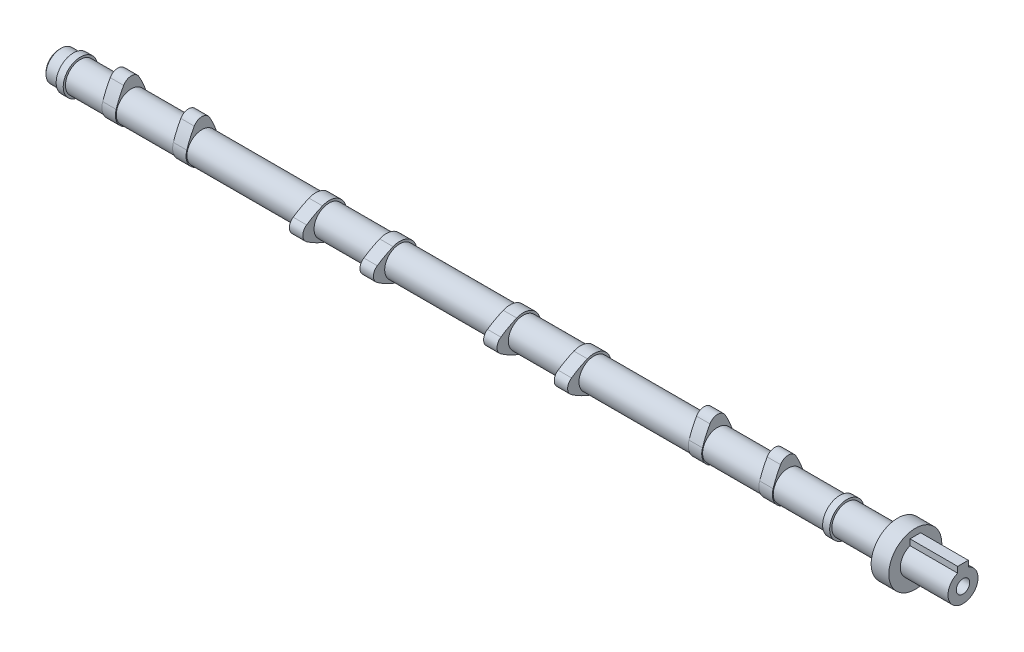
from build123d import *

# Parameters (mm, degrees)
CROQUIS1_W                       = 580
CROQUIS1_H                       = 8.5
CROQUIS4_R                       = 9.75
SALIENTE_EXTRUIR1_DEPTH          = 4
MATRIZL1_COUNT                   = 2
MATRIZL1_PITCH                   = 442
SALIENTE_EXTRUIR3_DEPTH          = 3.8
MATRIZL2_COUNT                   = 2
MATRIZL2_PITCH                   = 40
MATRIZL3_COUNT                   = 2
MATRIZL3_PITCH                   = 332
MATRIZL3_COPY_1_DEPTH            = 3.8
CROQUIS6_R                       = 8.5
SALIENTE_EXTRUIR4_DEPTH          = 3.8
MATRIZL4_COUNT                   = 2
MATRIZL4_PITCH                   = 40
MATRIZL5_COUNT                   = 2
MATRIZL5_PITCH                   = 110
MATRIZL5_COPY_1_SKETCH_R         = 8.5
MATRIZL5_COPY_1_DEPTH            = 3.8
CROQUIS7_R                       = 9.75
CORTAR_EXTRUIR1_DEPTH            = 12
CROQUIS8_R                       = 9.75
SALIENTE_EXTRUIR5_DEPTH          = 4
CROQUIS9_R                       = 8.5
SALIENTE_EXTRUIR6_DEPTH          = 8
CHAFL_N1_SIZE                    = 1
SALIENTE_EXTRUIR7_DEPTH          = 5
SALIENTE_EXTRUIR7_DEPTH_BACK     = 5
CROQUIS10_R                      = 15
CROQUIS11_W                      = 6
CROQUIS11_H                      = 3.35
SALIENTE_EXTRUIR8_DEPTH          = 40
CORTAR_EXTRUIR2_START            = -68.25
CROQUIS12_R                      = 42.065931182
CORTAR_EXTRUIR2_DEPTH            = 68.25
TALADRO_DE_MARGEN_PARA_M71_D     = 7.6
TALADRO_DE_MARGEN_PARA_M71_DEPTH = 30
TALADRO_DE_MARGEN_PARA_M71_TIP   = 2.283270352


with BuildPart() as part:
    # Croquis1 → Revolución1 (revolve)
    with BuildSketch(Plane.XY, mode=Mode.PRIVATE) as revoluci_n1_sk:
        with Locations((290, 4.25)):
            Rectangle(CROQUIS1_W, CROQUIS1_H)
    revolve(revoluci_n1_sk.sketch.rotate(Axis((0, 8.5, 0), (1, 0, 0)), 270), axis=Axis((0, 8.5, 0), (1, 0, 0)))

    # Croquis4 → Saliente-Extruir1 (add)
    with BuildSketch(Plane(origin=(580, 0, 0), x_dir=(0, 0, -1), z_dir=(1, 0, 0))):
        with Locations((0, 8.5)):
            Circle(CROQUIS4_R)
    saliente_extruir1 = extrude(amount=-SALIENTE_EXTRUIR1_DEPTH)

    # MatrizL1: Saliente-Extruir1 ×2
    with Locations(*[(-i * MATRIZL1_PITCH, 0, 0) for i in range(1, MATRIZL1_COUNT)]):
        add(saliente_extruir1)

    # Croquis5 → Saliente-Extruir3 (add, symmetric)
    with BuildSketch(Plane(origin=(171, 0, 0), x_dir=(0, 0, -1), z_dir=(1, 0, 0))):
        with BuildLine():
            ThreePointArc((-8.57686354, 11.227161863), (0, -0.5), (8.57686354, 11.227161863))
            ThreePointArc((8.57686354, 11.227161863), (6.71423124, 16.165722115), (4.341375372, 20.880415264))
            ThreePointArc((4.341375372, 20.880415264), (0, 23.4), (-4.341375372, 20.880415264))
            ThreePointArc((-4.341375372, 20.880415264), (-6.71423124, 16.165722115), (-8.57686354, 11.227161863))
        make_face()
    saliente_extruir3 = extrude(amount=SALIENTE_EXTRUIR3_DEPTH, both=True)

    # MatrizL2: Saliente-Extruir3 ×2
    with Locations(*[(i * MATRIZL2_PITCH, 0, 0) for i in range(1, MATRIZL2_COUNT)]):
        add(saliente_extruir3)

    # MatrizL3: Saliente-Extruir3 ×2
    with Locations(*[(i * MATRIZL3_PITCH, 0, 0) for i in range(1, MATRIZL3_COUNT)]):
        add(saliente_extruir3)

    # MatrizL3 copy 1 sketch → MatrizL3 copy 1 (add, symmetric)
    with BuildSketch(Plane(origin=(543, 0, 0), x_dir=(0, 0, -1), z_dir=(1, 0, 0))):
        with BuildLine():
            ThreePointArc((-8.57686354, 11.227161863), (0, -0.5), (8.57686354, 11.227161863))
            ThreePointArc((8.57686354, 11.227161863), (6.71423124, 16.165722115), (4.341375372, 20.880415264))
            ThreePointArc((4.341375372, 20.880415264), (0, 23.4), (-4.341375372, 20.880415264))
            ThreePointArc((-4.341375372, 20.880415264), (-6.71423124, 16.165722115), (-8.57686354, 11.227161863))
        make_face()
    extrude(amount=MATRIZL3_COPY_1_DEPTH, both=True)

    # Croquis6 → Saliente-Extruir4 (add, symmetric)
    with BuildSketch(Plane(origin=(281, 0, 0), x_dir=(0, 0, -1), z_dir=(1, 0, 0))):
        with BuildLine():
            ThreePointArc((-12.722376543, 12.627249768), (-14.9, 8.5), (-12.722376543, 4.372750232))
            ThreePointArc((-12.722376543, 4.372750232), (-8.363270987, 1.70804262), (-3.754994824, -0.497917196))
            ThreePointArc((-3.754994824, -0.497917196), (9.75, 8.5), (-3.754994824, 17.497917196))
            ThreePointArc((-3.754994824, 17.497917196), (-8.363270987, 15.29195738), (-12.722376543, 12.627249768))
        make_face()
        with Locations(Location((0, 8.5, 0), (0, 0, 180))):
            Circle(CROQUIS6_R, mode=Mode.SUBTRACT)
    saliente_extruir4 = extrude(amount=SALIENTE_EXTRUIR4_DEPTH, both=True)

    # MatrizL4: Saliente-Extruir4 ×2
    with Locations(*[(i * MATRIZL4_PITCH, 0, 0) for i in range(1, MATRIZL4_COUNT)]):
        add(saliente_extruir4)

    # MatrizL5: Saliente-Extruir4 ×2
    with Locations(*[(i * MATRIZL5_PITCH, 0, 0) for i in range(1, MATRIZL5_COUNT)]):
        add(saliente_extruir4)

    # MatrizL5 copy 1 sketch → MatrizL5 copy 1 (add, symmetric)
    with BuildSketch(Plane(origin=(431, 0, 0), x_dir=(0, 0, -1), z_dir=(1, 0, 0))):
        with BuildLine():
            ThreePointArc((-12.722376543, 12.627249768), (-14.9, 8.5), (-12.722376543, 4.372750232))
            ThreePointArc((-12.722376543, 4.372750232), (-8.363270987, 1.70804262), (-3.754994824, -0.497917196))
            ThreePointArc((-3.754994824, -0.497917196), (9.75, 8.5), (-3.754994824, 17.497917196))
            ThreePointArc((-3.754994824, 17.497917196), (-8.363270987, 15.29195738), (-12.722376543, 12.627249768))
        make_face()
        with Locations(Location((0, 8.5, 0), (0, 0, 180))):
            Circle(MATRIZL5_COPY_1_SKETCH_R, mode=Mode.SUBTRACT)
    extrude(amount=MATRIZL5_COPY_1_DEPTH, both=True)


with BuildPart() as body_2:
    # Simetría1: mirrored copy
    add(part.part.mirror(Plane.ZY))

    # Croquis7 → Cortar-Extruir1 (cut)
    with BuildSketch(Plane.ZY.offset(580)):
        with Locations(Location((0, 8.5, 0), (0, 0, 180))):
            Circle(CROQUIS7_R)
    extrude(amount=-CORTAR_EXTRUIR1_DEPTH, mode=Mode.SUBTRACT)

    # Croquis8 → Saliente-Extruir5 (add)
    with BuildSketch(Plane.ZY.offset(568)):
        with Locations(Location((0, 8.5, 0), (0, 0, 180))):
            Circle(CROQUIS8_R)
    extrude(amount=SALIENTE_EXTRUIR5_DEPTH)

    # Croquis9 → Saliente-Extruir6 (add)
    with BuildSketch(Plane.ZY.offset(572)):
        with Locations((0, 8.5)):
            Circle(CROQUIS9_R)
    extrude(amount=SALIENTE_EXTRUIR6_DEPTH)

    # Chaflán1
    chafl_n1_edges = [body_2.edges().sort_by_distance(p)[0] for p in [
        (-580, 8.5, -8.5),
    ]]
    chamfer(chafl_n1_edges, length=CHAFL_N1_SIZE)

    # Croquis10 → Saliente-Extruir7 (add, two sides: drawn at the far end of the back side and taken through both)
    with BuildSketch(Plane(origin=(-100.25, 0, 0), x_dir=(0, 0, -1), z_dir=(1, 0, 0)).offset(-SALIENTE_EXTRUIR7_DEPTH_BACK)):
        with Locations((0, 8.5)):
            Circle(CROQUIS10_R)
    extrude(amount=SALIENTE_EXTRUIR7_DEPTH + SALIENTE_EXTRUIR7_DEPTH_BACK)

    # Croquis11 → Saliente-Extruir8 (add)
    with BuildSketch(Plane(origin=(-95.25, 0, 0), x_dir=(0, 0, -1), z_dir=(1, 0, 0))):
        with Locations((0, 18.12798686)):
            Rectangle(CROQUIS11_W, CROQUIS11_H)
    extrude(amount=SALIENTE_EXTRUIR8_DEPTH)

    # Croquis12 → Cortar-Extruir2 (cut)
    with BuildSketch(Plane(origin=(0, 0, 0), x_dir=(0, 0, -1), z_dir=(1, 0, 0)).offset(CORTAR_EXTRUIR2_START)):
        with Locations((0, 8.5)):
            Circle(CROQUIS12_R)
    extrude(amount=CORTAR_EXTRUIR2_DEPTH, mode=Mode.SUBTRACT)

    # Taladro de margen para M71
    with Locations(Plane(origin=(-68.25, 8.5, 0), x_dir=(0, 0, 1), z_dir=(1, 0, 0))):
        with Locations((0, 0)):
            Hole(TALADRO_DE_MARGEN_PARA_M71_D / 2, depth=TALADRO_DE_MARGEN_PARA_M71_DEPTH)
            with Locations((0, 0, -(TALADRO_DE_MARGEN_PARA_M71_DEPTH + TALADRO_DE_MARGEN_PARA_M71_TIP / 2))):  # 118° drill point
                Cone(0, TALADRO_DE_MARGEN_PARA_M71_D / 2, TALADRO_DE_MARGEN_PARA_M71_TIP, mode=Mode.SUBTRACT)


solid = body_2.part
